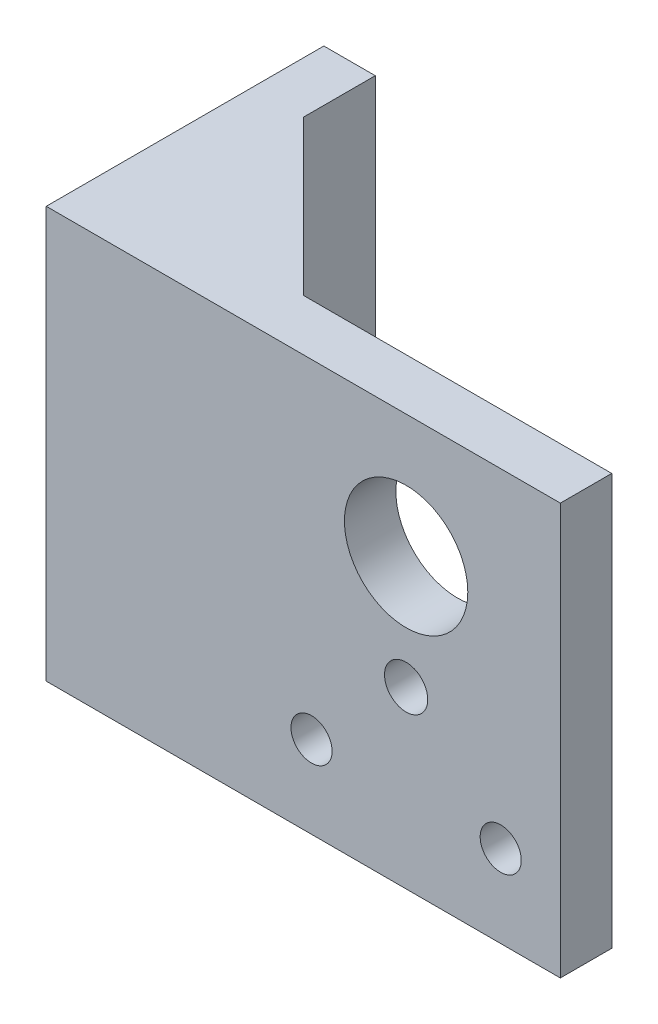
from build123d import *

# Parameters (mm, degrees)
BOSS_EXTRUDE1_DEPTH = 40
CUT_EXTRUDE1_DEPTH  = 35
BOSS_EXTRUDE2_DEPTH = 5
SKETCH6_R           = 2
CUT_EXTRUDE2_DEPTH  = 70.641941386
SKETCH7_R           = 3.2
SKETCH7_R_2         = 2.1
SKETCH7_R_3         = 2
CUT_EXTRUDE4_DEPTH  = 18.4
SKETCH9_R           = 5.05
CUT_EXTRUDE5_DEPTH  = 3
SKETCH10_R          = 6
CUT_EXTRUDE6_DEPTH  = 73.972597597
SKETCH11_W          = 8
SKETCH11_H          = 40
CUT_EXTRUDE7_DEPTH  = 70.641941386


with BuildPart() as part:
    # Sketch1 → Boss-Extrude1 (new body)
    with BuildSketch(Plane(origin=(0, 0, 0), x_dir=(1, 0, 0), z_dir=(0, 1, 0))):
        Polygon((0, 0), (50, 0), (50, 5), (20, 5), (5, 20), (5, 35), (0, 35), align=None)
    extrude(amount=BOSS_EXTRUDE1_DEPTH)

    # Sketch3 → Cut-Extrude1 (cut)
    with BuildSketch(Plane.XZ):
        Polygon((5, -20), (5, -5), (20, -5), align=None)
    extrude(amount=-CUT_EXTRUDE1_DEPTH, mode=Mode.SUBTRACT)

    # Sketch5 → Boss-Extrude2 (add)
    with BuildSketch(Plane.XZ):
        Polygon((5, -20), (5, -5), (20, -5), align=None)
    extrude(amount=-BOSS_EXTRUDE2_DEPTH)

    # Sketch6 → Cut-Extrude2 (cut, through all)
    with BuildSketch(Plane(origin=(5, 0, 0), x_dir=(0, 0, -1), z_dir=(1, 0, 0))):
        with Locations((13, 30)):
            Circle(SKETCH6_R)
        with Locations((13, 10)):
            Circle(SKETCH6_R)
        with Locations((21, 20)):
            Circle(SKETCH6_R)
    extrude(amount=-CUT_EXTRUDE2_DEPTH, mode=Mode.SUBTRACT)

    # Sketch7 → Cut-Extrude4 (cut)
    with BuildSketch(Plane(origin=(0, 0, -5), x_dir=(-1, 0, 0), z_dir=(0, 0, -1))):
        with Locations((-35, 28)):
            Circle(SKETCH7_R)
        with Locations((-35, 17)):
            Circle(SKETCH7_R_2)
        with Locations((-25.8, 8)):
            Circle(SKETCH7_R_3)
        with Locations((-44.2, 8)):
            Circle(SKETCH7_R_3)
    extrude(amount=-CUT_EXTRUDE4_DEPTH, mode=Mode.SUBTRACT)

    # Sketch9 → Cut-Extrude5 (cut)
    with BuildSketch(Plane.XY):
        with Locations((35, 28)):
            Circle(SKETCH9_R)
    extrude(amount=-CUT_EXTRUDE5_DEPTH, mode=Mode.SUBTRACT)

    # Sketch10 → Cut-Extrude6 (cut, through all)
    with BuildSketch(Plane.XY):
        with Locations((35, 28)):
            Circle(SKETCH10_R)
    extrude(amount=-CUT_EXTRUDE6_DEPTH, mode=Mode.SUBTRACT)

    # Sketch11 → Cut-Extrude7 (cut, through all)
    with BuildSketch(Plane(origin=(5, 0, 0), x_dir=(0, 0, -1), z_dir=(1, 0, 0))):
        with Locations((31, 20)):
            Rectangle(SKETCH11_W, SKETCH11_H)
    extrude(amount=-CUT_EXTRUDE7_DEPTH, mode=Mode.SUBTRACT)


solid = part.part
